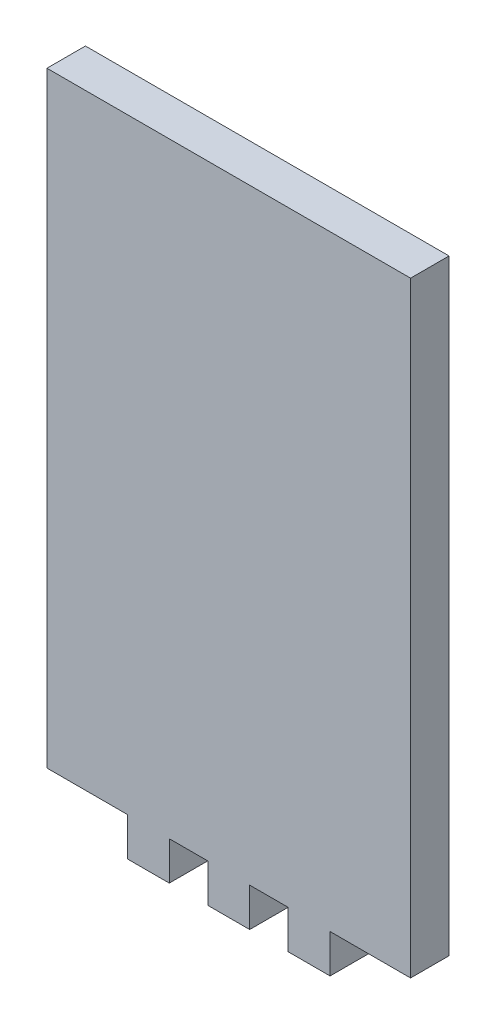
from build123d import *

# Parameters (mm, degrees)
BOSS_EXTRUDE1_DEPTH = 6.35


with BuildPart() as part:
    # Sketch1 → Boss-Extrude1 (new body)
    with BuildSketch(Plane.XY):
        Polygon((26.542, 0), (26.542, 6.35), (20.182, 6.35), (20.182, 0), (13.272, 0), (13.272, 6.35), (6.912, 6.35), (0, 6.35), (0, 106.36), (60, 106.36), (60, 6.35), (53.082, 6.35), (46.722, 6.35), (46.722, 0), (39.812, 0), (39.812, 6.35), (33.452, 6.35), (33.452, 0), align=None)
    extrude(amount=BOSS_EXTRUDE1_DEPTH)


solid = part.part
